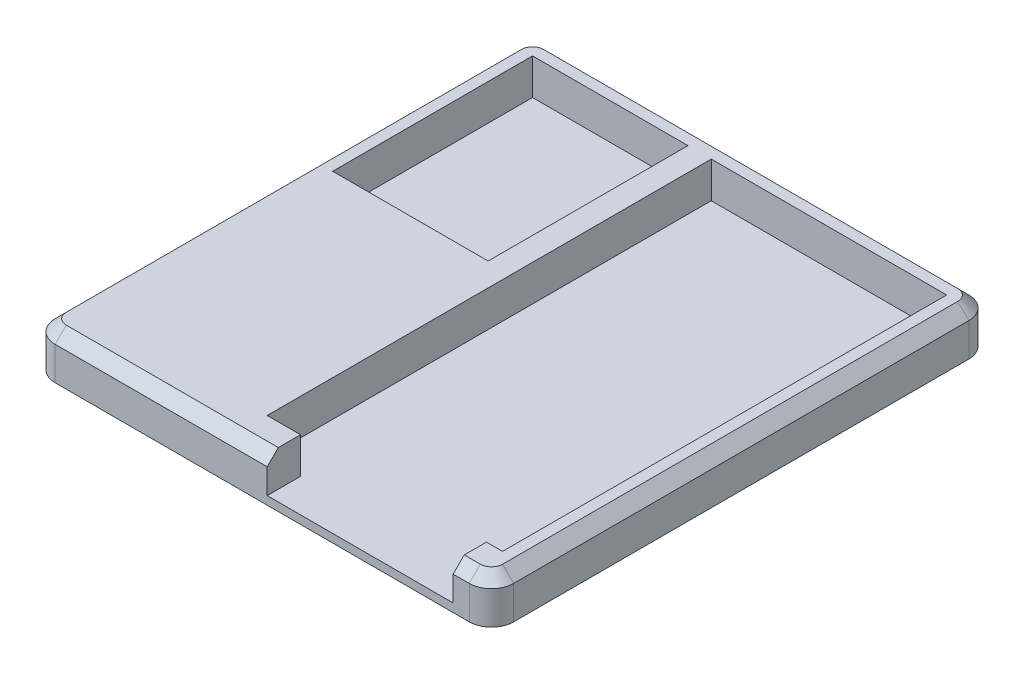
from build123d import *

# Parameters (mm, degrees)
SKETCH1_W           = 104.902
SKETCH1_H           = 114.3
BOSS_EXTRUDE1_DEPTH = 10.16
SKETCH2_W           = 35.56
SKETCH2_H           = 45.72
CUT_EXTRUDE1_DEPTH  = 8.255
SKETCH3_W           = 53.848
SKETCH3_H           = 101.6
CUT_EXTRUDE2_DEPTH  = 8.255
CUT_EXTRUDE3_DEPTH  = 8.255
FILLET1_R           = 5.08
CHAMFER1_SIZE       = 2.54


with BuildPart() as part:
    # Sketch1 → Boss-Extrude1 (new body)
    with BuildSketch(Plane(origin=(0, 0, 0), x_dir=(1, 0, 0), z_dir=(0, 1, 0))):
        Rectangle(SKETCH1_W, SKETCH1_H)
    extrude(amount=BOSS_EXTRUDE1_DEPTH)

    # Sketch2 → Cut-Extrude1 (cut)
    with BuildSketch(Plane(origin=(0, 10.16, 0), x_dir=(1, 0, 0), z_dir=(0, 1, 0))):
        with Locations((-29.591, 29.21)):
            Rectangle(SKETCH2_W, SKETCH2_H)
    extrude(amount=-CUT_EXTRUDE1_DEPTH, mode=Mode.SUBTRACT)

    # Sketch3 → Cut-Extrude2 (cut)
    with BuildSketch(Plane(origin=(0, 10.16, 0), x_dir=(1, 0, 0), z_dir=(0, 1, 0))):
        with Locations((20.447, 1.27)):
            Rectangle(SKETCH3_W, SKETCH3_H)
    extrude(amount=-CUT_EXTRUDE2_DEPTH, mode=Mode.SUBTRACT)

    # Sketch4 → Cut-Extrude3 (cut)
    with BuildSketch(Plane(origin=(0, 10.16, 0), x_dir=(1, 0, 0), z_dir=(0, 1, 0))):
        Polygon((1.143, -49.53), (13.843, -49.53), (33.528, -49.53), (43.688, -49.53), (43.688, -57.15), (33.528, -57.15), (15.4686, -57.15), (1.143, -57.15), align=None)
    extrude(amount=-CUT_EXTRUDE3_DEPTH, mode=Mode.SUBTRACT)

    # Fillet1
    fillet1_edges = [part.edges().sort_by_distance(p)[0] for p in [
        (-52.451, 5.08, -57.15),
        (52.451, 5.08, -57.15),
        (52.451, 5.08, 57.15),
        (-52.451, 5.08, 57.15),
    ]]
    fillet(fillet1_edges, radius=FILLET1_R)

    # Chamfer1
    chamfer1_edges = [part.edges().sort_by_distance(p)[0] for p in [
        (45.5295, 10.16, 57.15),
        (52.451, 10.16, 0),
        (-23.114, 10.16, 57.15),
        (0, 10.16, -57.15),
        (-52.451, 10.16, 0),
        (50.963102448, 10.16, -55.662102448),
        (-50.963102448, 10.16, -55.662102448),
        (-50.963102448, 10.16, 55.662102448),
        (50.963102448, 10.16, 55.662102448),
    ]]
    chamfer(chamfer1_edges, length=CHAMFER1_SIZE)


solid = part.part
